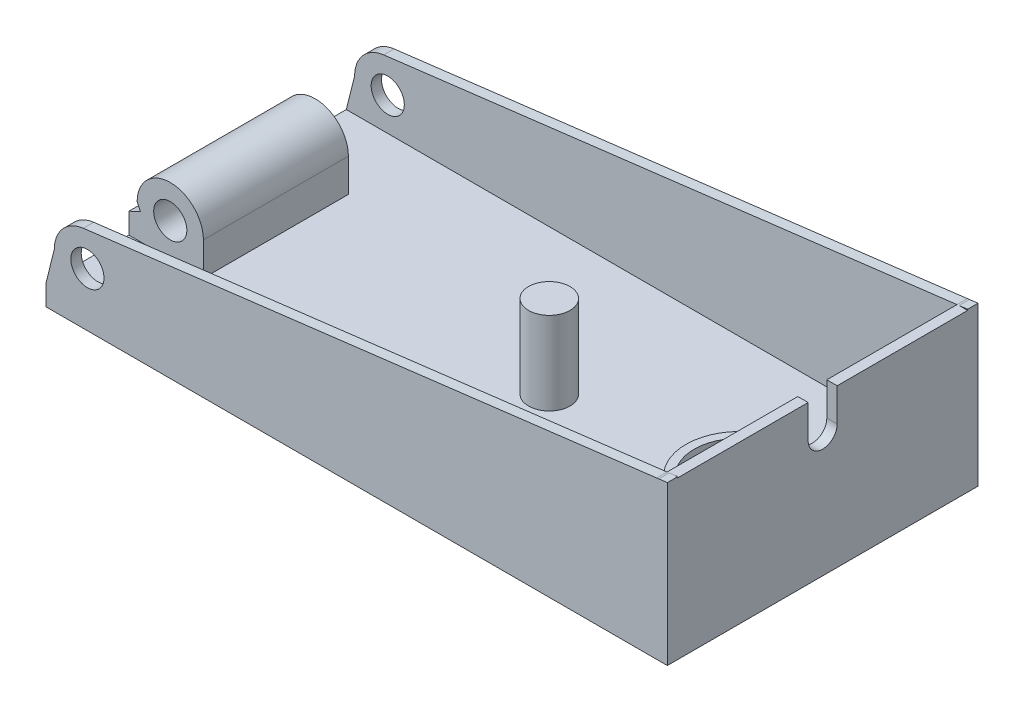
from build123d import *

# Parameters (mm, degrees)
SKETCH2_W               = 150
SKETCH2_H               = 75
BOSS_EXTRUDE1_DEPTH     = 2.5
SKETCH3_R               = 4
BOSS_EXTRUDE2_DEPTH     = 17.5
SKETCH4_R               = 5
BOSS_EXTRUDE3_DEPTH     = 20
SKETCH7_R               = 13
SKETCH7_R_2             = 11
BOSS_EXTRUDE4_DEPTH     = 6
BOSS_EXTRUDE5_START     = 37.5
BOSS_EXTRUDE5_DEPTH     = 2.5
BOSS_EXTRUDE6_START     = -35
BOSS_EXTRUDE6_DEPTH     = 2.5
BOSS_EXTRUDE7_DEPTH     = 2.5
SKETCH11_W              = 3
SKETCH11_H              = 65
BOSS_EXTRUDE8_DEPTH     = 1
CUT_EXTRUDE1_DEPTH      = 112.930169188
CUT_EXTRUDE1_DEPTH_BACK = 112.930169188
SKETCH12_R              = 4


with BuildPart() as part:
    # Sketch2 → Boss-Extrude1 (new, symmetric)
    with BuildSketch(Plane(origin=(0, 0, 0), x_dir=(1, 0, 0), z_dir=(0, 1, 0))):
        Rectangle(SKETCH2_W, SKETCH2_H)
    extrude(amount=BOSS_EXTRUDE1_DEPTH, both=True)

    # Sketch3 → Boss-Extrude2 (add, symmetric)
    with BuildSketch(Plane.XY):
        with BuildLine():
            Line((-57, 10.5), (-57, 2.5))
            Line((-57, 2.5), (-75, 2.5))
            Line((-75, 2.5), (-75, 7.5))
            Line((-75, 7.5), (-72.208145726, 8.801863029))
            Line((-72.208145726, 8.801863029), (-73, 10.5))
            ThreePointArc((-73, 10.5), (-65, 18.5), (-57, 10.5))
        make_face()
        with Locations((-65, 10.5)):
            Circle(SKETCH3_R, mode=Mode.SUBTRACT)
    extrude(amount=BOSS_EXTRUDE2_DEPTH, both=True)

    # Sketch4 → Boss-Extrude3 (add)
    with BuildSketch(Plane(origin=(0, 2.5, 0), x_dir=(1, 0, 0), z_dir=(0, 1, 0))):
        with Locations(Location((9, 0, 0), (0, 0, 270))):
            Circle(SKETCH4_R)
    extrude(amount=BOSS_EXTRUDE3_DEPTH)

    # Sketch7 → Boss-Extrude4 (add)
    with BuildSketch(Plane(origin=(0, 2.5, 0), x_dir=(1, 0, 0), z_dir=(0, 1, 0))):
        with Locations(Location((55, 0, 0), (0, 0, 270))):
            Circle(SKETCH7_R)
        with Locations(Location((55, 0, 0), (0, 0, 270))):
            Circle(SKETCH7_R_2, mode=Mode.SUBTRACT)
    extrude(amount=BOSS_EXTRUDE4_DEPTH)

    # Sketch9 → Boss-Extrude5 (add)
    with BuildSketch(Plane.XY.offset(BOSS_EXTRUDE5_START)):
        with BuildLine():
            Line((75, 35.754199396), (75, 2.5))
            Line((75, 2.5), (-75, 2.5))
            Line((-75, 2.5), (-73, 10.5))
            ThreePointArc((-73, 10.5), (-70.991725081, 15.800870736), (-65.975192361, 18.440340034))
            Line((-65.975192361, 18.440340034), (75, 35.754199396))
        make_face()
    extrude(amount=-BOSS_EXTRUDE5_DEPTH)

    # Sketch9<2> → Boss-Extrude6 (add)
    with BuildSketch(Plane.XY.offset(BOSS_EXTRUDE6_START)):
        with BuildLine():
            Line((75, 35.754199396), (75, 2.5))
            Line((75, 2.5), (-75, 2.5))
            Line((-75, 2.5), (-73, 10.5))
            ThreePointArc((-73, 10.5), (-70.991725081, 15.800870736), (-65.975192361, 18.440340034))
            Line((-65.975192361, 18.440340034), (75, 35.754199396))
        make_face()
    extrude(amount=-BOSS_EXTRUDE6_DEPTH)

    # Sketch10 → Boss-Extrude7 (add)
    with BuildSketch(Plane(origin=(75, 0, 0), x_dir=(0, 0, -1), z_dir=(1, 0, 0))):
        with BuildLine():
            Line((37.5, 35.5), (37.5, -2.5))
            Line((37.5, -2.5), (-37.5, -2.5))
            Line((-37.5, -2.5), (-37.5, 35.5))
            Line((-37.5, 35.5), (-3.5, 35.5))
            Line((-3.5, 35.5), (-3.5, 27.5))
            ThreePointArc((-3.5, 27.5), (0, 24), (3.5, 27.5))
            Line((3.5, 27.5), (3.5, 35.5))
            Line((3.5, 35.5), (37.5, 35.5))
        make_face()
    extrude(amount=-BOSS_EXTRUDE7_DEPTH)

    # Sketch11 → Boss-Extrude8 (add)
    with BuildSketch(Plane.XZ.offset(2.5)):
        with Locations((-45, 0)):
            Rectangle(SKETCH11_W, SKETCH11_H)
        with Locations((-35, 0)):
            Rectangle(SKETCH11_W, SKETCH11_H)
        with Locations((-25, 0)):
            Rectangle(SKETCH11_W, SKETCH11_H)
        with Locations((-15, 0)):
            Rectangle(SKETCH11_W, SKETCH11_H)
        with Locations((-5, 0)):
            Rectangle(SKETCH11_W, SKETCH11_H)
        with Locations((5, 0)):
            Rectangle(SKETCH11_W, SKETCH11_H)
        with Locations((15, 0)):
            Rectangle(SKETCH11_W, SKETCH11_H)
        with Locations((25, 0)):
            Rectangle(SKETCH11_W, SKETCH11_H)
        with Locations((35, 0)):
            Rectangle(SKETCH11_W, SKETCH11_H)
        with Locations((45, 0)):
            Rectangle(SKETCH11_W, SKETCH11_H)
        with Locations((55, 0)):
            Rectangle(SKETCH11_W, SKETCH11_H)
        with Locations((65, 0)):
            Rectangle(SKETCH11_W, SKETCH11_H)
        with Locations((-65, 0)):
            Rectangle(SKETCH11_W, SKETCH11_H)
        with Locations((-55, 0)):
            Rectangle(SKETCH11_W, SKETCH11_H)
    extrude(amount=BOSS_EXTRUDE8_DEPTH)

    # Sketch12 → Cut-Extrude1 (cut, two sides: drawn at the far end of the back side and taken through both)
    with BuildSketch(Plane(origin=(0, 0, -37.5), x_dir=(-1, 0, 0), z_dir=(0, 0, -1)).offset(-CUT_EXTRUDE1_DEPTH_BACK)):
        with Locations(Location((65, 10.5, 0), (0, 0, 180))):
            Circle(SKETCH12_R)
    extrude(amount=CUT_EXTRUDE1_DEPTH + CUT_EXTRUDE1_DEPTH_BACK, mode=Mode.SUBTRACT)


solid = part.part
